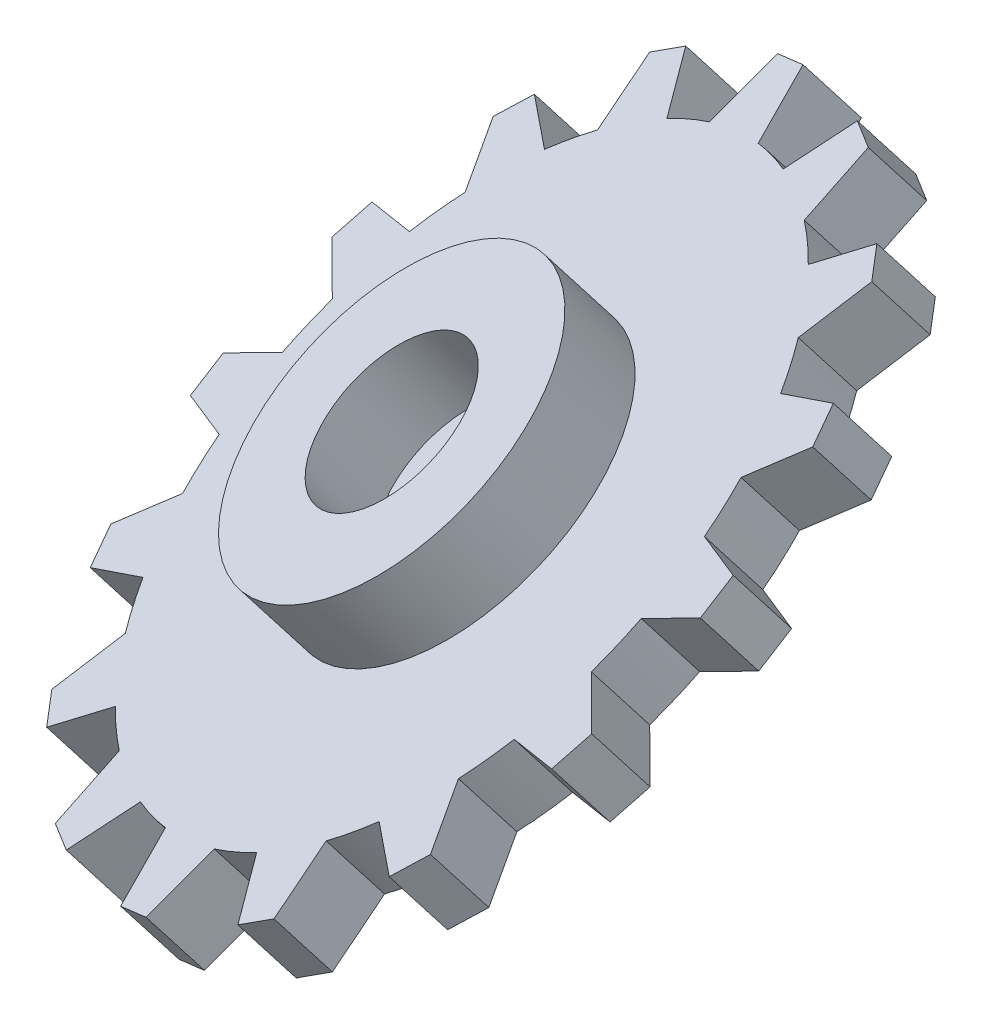
from build123d import *

# Parameters (mm, degrees)
SKETCH1_R           = 50
EXTRUDE1_DEPTH      = 10
EXTRUDE2_DEPTH      = 10
CIRPATTERN1_COUNT   = 16
SKETCH3_R           = 42.5
CUT_EXTRUDE1_DEPTH  = 2
EXTRUDE3_DEPTH      = 10
EXTRUDE3_DEPTH_BACK = 20
SKETCH4_R           = 25
SKETCH4_R_2         = 12.5


with BuildPart() as part:
    # Sketch1 → Extrude1 (new body)
    with BuildSketch(Plane(origin=(-35.411572528, 65.609323585, -43.044793763), x_dir=(0.661608716570187, 0.6269595397180289, -0.4113339783131309), z_dir=(0.411333978313131, -0.7621052147079792, -0.49999999999999767))):
        with Locations(Location((-35.411572528, 65.609323585, 0), (0, 0, 313.459706489))):
            Circle(SKETCH1_R)
    extrude(amount=EXTRUDE1_DEPTH)

    # Sketch2 → Extrude2 (add)
    with BuildSketch(Plane(origin=(-13.592446481, 25.183609646, 16.522396881), x_dir=(0.661608716570187, 0.6269595397180289, -0.4113339783131309), z_dir=(0.4113339783131311, -0.7621052147079793, -0.4999999999999976))):
        Polygon((-3, 60), (3, 60), (8.358983849, 40), (-8.358983849, 40), align=None)
    extrude2 = extrude(amount=-EXTRUDE2_DEPTH)

    # CirPattern1: Extrude2 ×16 about axis
    cirpattern1_axis = Axis((0, 0, 0), (-0.41133397831313073, 0.7621052147079793, 0.4999999999999978))
    for i in range(1, CIRPATTERN1_COUNT):
        add(extrude2.rotate(cirpattern1_axis, i * 360 / CIRPATTERN1_COUNT))

    # Sketch3 → Cut-Extrude1 (cut)
    with BuildSketch(Plane(origin=(-13.592446481, 25.183609646, 16.522396881), x_dir=(0.661608716570187, 0.6269595397180289, -0.4113339783131309), z_dir=(0.4113339783131311, -0.7621052147079793, -0.4999999999999976))):
        with Locations(Location((0, 0, 0), (0, 0, 313.459706489))):
            Circle(SKETCH3_R)
    extrude(amount=-CUT_EXTRUDE1_DEPTH, mode=Mode.SUBTRACT)

    # Sketch4 → Extrude3 (add, two sides: drawn at the far end of the back side and taken through both)
    with BuildSketch(Plane(origin=(-14.415114438, 26.707820075, 17.522396881), x_dir=(0.661608716570187, 0.626959539718029, -0.41133397831313107), z_dir=(0.4113339783131311, -0.7621052147079793, -0.49999999999999756)).offset(-EXTRUDE3_DEPTH_BACK)):
        with Locations(Location((0, 0, 0), (0, 0, 313.459706489))):
            Circle(SKETCH4_R)
        with Locations(Location((0, 0, 0), (0, 0, 313.459706489))):
            Circle(SKETCH4_R_2, mode=Mode.SUBTRACT)
    extrude(amount=EXTRUDE3_DEPTH + EXTRUDE3_DEPTH_BACK)


solid = part.part
